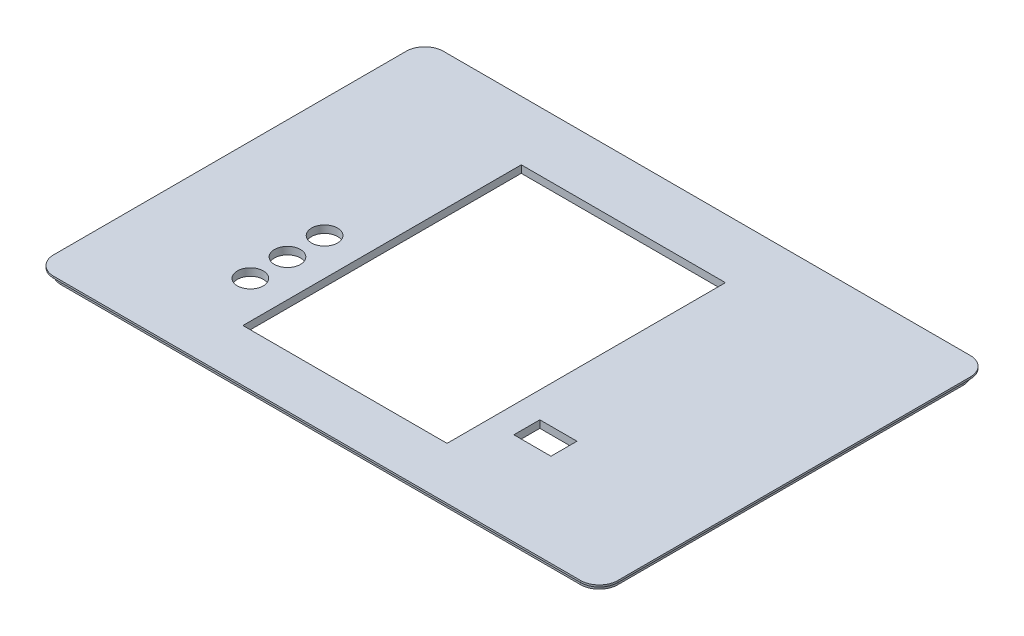
from build123d import *

# Parameters (mm, degrees)
EXTRUDE_5_DEPTH      = 0.5
EXTRUDE_6_DEPTH      = 1.5
SKETCH_19_W          = 55
SKETCH_19_H          = 75
CUT_EXTRUDE_10_DEPTH = 33
SKETCH_20_W          = 10
SKETCH_20_H          = 7
CUT_EXTRUDE_11_DEPTH = 33
SKETCH_21_R          = 3.5
CUT_EXTRUDE_12_DEPTH = 33


with BuildPart() as part:
    # 草图16 → 凸台-拉伸5 (new body)
    with BuildSketch(Plane(origin=(0, 0, 0), x_dir=(1, 0, 0), z_dir=(0, 1, 0))):
        with BuildLine():
            Line((71, -52.5), (-71, -52.5))
            ThreePointArc((-71, -52.5), (-74.535533906, -51.035533906), (-76, -47.5))
            Line((-76, -47.5), (-76, 47.5))
            ThreePointArc((-76, 47.5), (-74.535533906, 51.035533906), (-71, 52.5))
            Line((-71, 52.5), (71, 52.5))
            ThreePointArc((71, 52.5), (74.535533906, 51.035533906), (76, 47.5))
            Line((76, 47.5), (76, -47.5))
            ThreePointArc((76, -47.5), (74.535533906, -51.035533906), (71, -52.5))
        make_face()
    extrude(amount=EXTRUDE_5_DEPTH)

    # 草图18 → 凸台-拉伸6 (add)
    with BuildSketch(Plane.XZ):
        with BuildLine():
            Line((70, -51.5), (-70, -51.5))
            ThreePointArc((-70, -51.5), (-73.535533906, -50.035533906), (-75, -46.5))
            Line((-75, -46.5), (-75, 46.5))
            ThreePointArc((-75, 46.5), (-73.535533906, 50.035533906), (-70, 51.5))
            Line((-70, 51.5), (70, 51.5))
            ThreePointArc((70, 51.5), (73.535533906, 50.035533906), (75, 46.5))
            Line((75, 46.5), (75, -46.5))
            ThreePointArc((75, -46.5), (73.535533906, -50.035533906), (70, -51.5))
        make_face()
    extrude(amount=EXTRUDE_6_DEPTH)

    # 草图19 → 切除-拉伸10 (cut)
    with BuildSketch(Plane(origin=(0, 0.5, 0), x_dir=(1, 0, 0), z_dir=(0, 1, 0))):
        with Locations((-6.5, -1)):
            Rectangle(SKETCH_19_W, SKETCH_19_H)
    extrude(amount=-CUT_EXTRUDE_10_DEPTH, mode=Mode.SUBTRACT)

    # 草图20 → 切除-拉伸11 (cut)
    with BuildSketch(Plane(origin=(0, 0.5, 0), x_dir=(1, 0, 0), z_dir=(0, 1, 0))):
        with Locations((33, -24)):
            Rectangle(SKETCH_20_W, SKETCH_20_H)
    extrude(amount=-CUT_EXTRUDE_11_DEPTH, mode=Mode.SUBTRACT)

    # 草图21 → 切除-拉伸12 (cut)
    with BuildSketch(Plane(origin=(0, 0.5, 0), x_dir=(1, 0, 0), z_dir=(0, 1, 0))):
        with Locations(Location((-44, -6.5, 0), (0, 0, 270))):
            Circle(SKETCH_21_R)
        with Locations(Location((-44, -16.5, 0), (0, 0, 270))):
            Circle(SKETCH_21_R)
        with Locations(Location((-44, -26.5, 0), (0, 0, 270))):
            Circle(SKETCH_21_R)
    extrude(amount=-CUT_EXTRUDE_12_DEPTH, mode=Mode.SUBTRACT)


solid = part.part
